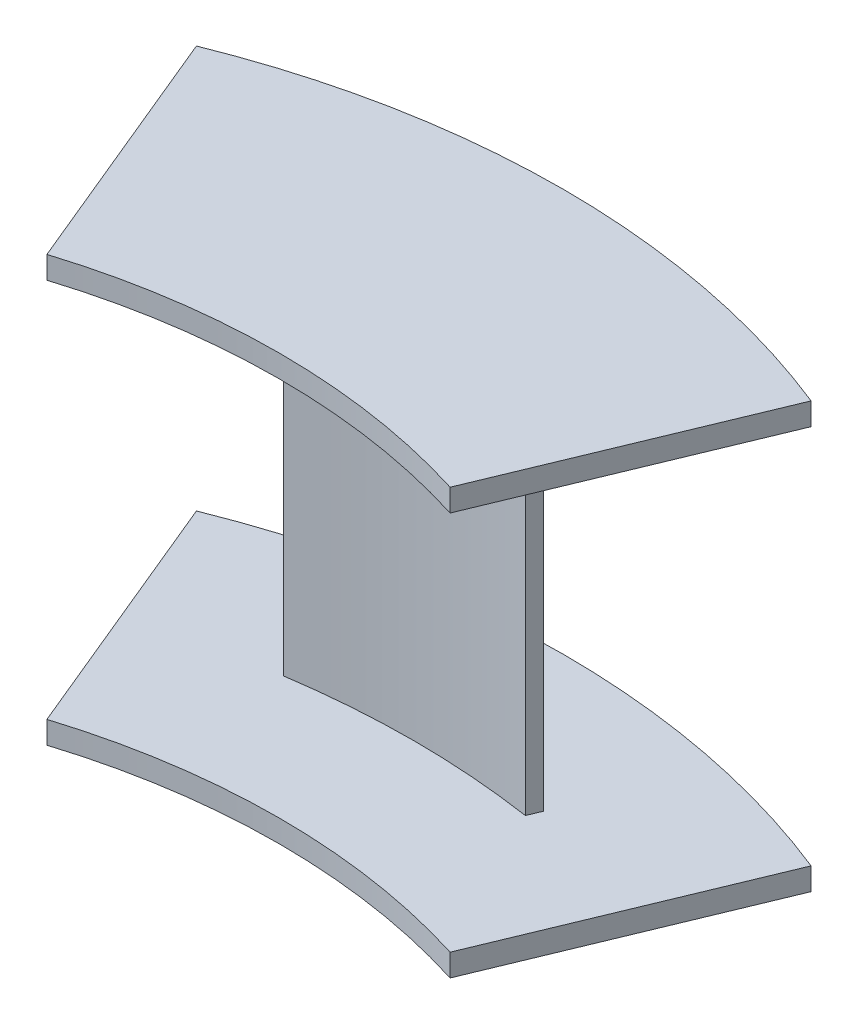
from build123d import *

# Parameters (mm, degrees)
BOSS_EXTRUDE1_DEPTH = 2.5
BOSS_EXTRUDE2_DEPTH = 85


with BuildPart() as part:
    # Sketch1 → Boss-Extrude1 (new, symmetric)
    with BuildSketch(Plane(origin=(0, 0, 0), x_dir=(1, 0, 0), z_dir=(0, 1, 0))):
        with BuildLine():
            Line((-46.169490158, -34.493062002), (-69.80030965, 22.556782905))
            ThreePointArc((-69.80030965, 22.556782905), (-1.110079213, 35.825157058), (67.580151223, 22.556782905))
            Line((67.580151223, 22.556782905), (43.949331732, -34.493062002))
            ThreePointArc((43.949331732, -34.493062002), (-1.110079213, -27.613322498), (-46.169490158, -34.493062002))
        make_face()
    boss_extrude1 = extrude(amount=BOSS_EXTRUDE1_DEPTH, both=True)

    # Sketch2 → Boss-Extrude2 (add)
    with BuildSketch(Plane(origin=(0, 2.5, 0), x_dir=(1, 0, 0), z_dir=(0, 1, 0))):
        with BuildLine():
            Line((-29.32170103, 3.22655488), (-28.133506793, 0.358000238))
            ThreePointArc((-28.133506793, 0.358000238), (-1.110079213, 2.386677502), (25.913348366, 0.358000238))
            Line((25.913348366, 0.358000238), (27.101542603, 3.22655488))
            ThreePointArc((27.101542603, 3.22655488), (-1.110079213, 5.825157058), (-29.32170103, 3.22655488))
        make_face()
    extrude(amount=BOSS_EXTRUDE2_DEPTH)

    # Mirror1: Boss-Extrude1 across plane
    add(boss_extrude1.mirror(Plane.ZX.offset(45)))


solid = part.part
